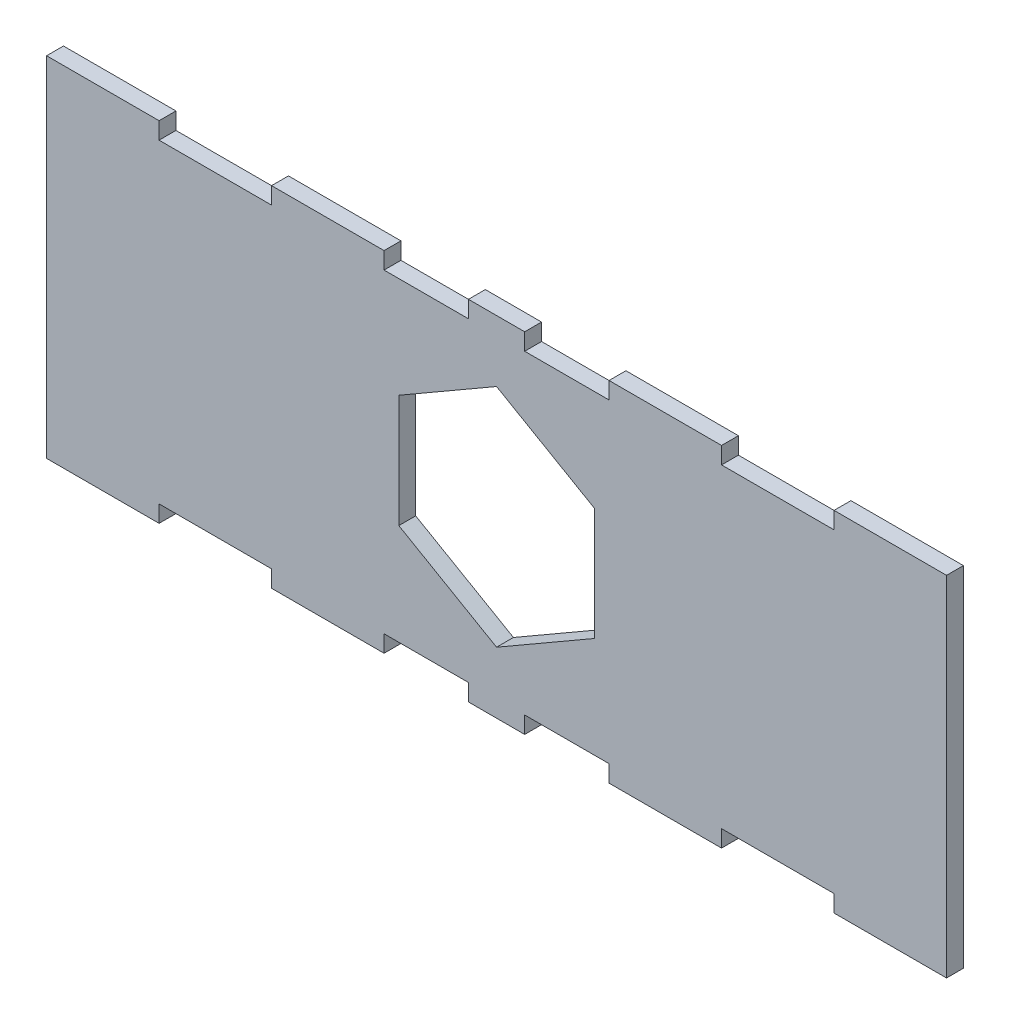
from build123d import *

# Parameters (mm, degrees)
P_IDAT_VYSUNUT_M1_DEPTH = 3


with BuildPart() as part:
    # Skica1 → Přidat vysunutím1 (new body)
    with BuildSketch(Plane.XY):
        Polygon((20, 3), (23.5, 3), (40, 3), (40, 0), (60, 0), (60, 3), (75, 3), (75, 0), (85, 0), (85, 3), (100, 3), (100, 0), (120, 0), (120, 3), (136.5, 3), (140, 3), (140, 0), (160, 0), (160, 62), (140, 62), (140, 59), (120, 59), (120, 62), (100, 62), (100, 59), (85, 59), (85, 62), (75, 62), (75, 59), (60, 59), (60, 62), (40, 62), (40, 59), (20, 59), (20, 62), (0, 62), (0, 0), (20, 0), align=None)
        Polygon((80, 51.06787282), (62.620712338, 41.03393641), (62.620712338, 20.96606359), (80, 10.93212718), (97.379287662, 20.96606359), (97.379287662, 41.03393641), align=None, mode=Mode.SUBTRACT)
    extrude(amount=P_IDAT_VYSUNUT_M1_DEPTH)


solid = part.part
